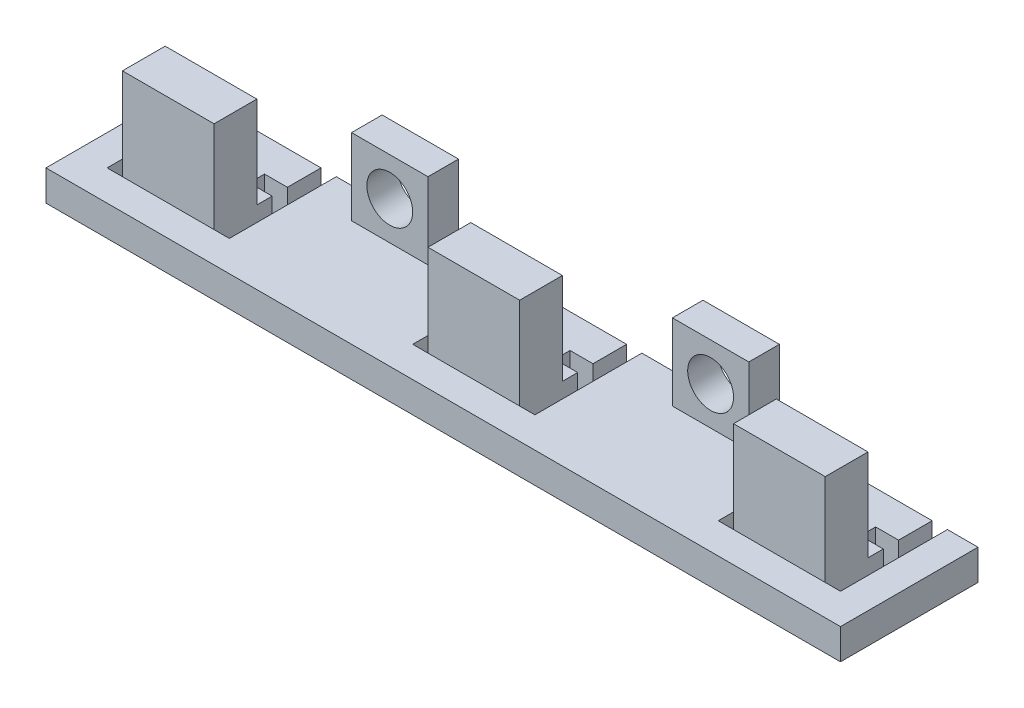
from build123d import *

# Parameters (mm, degrees)
SKETCH_1_W             = 52
SKETCH_1_H             = 9
EXTRUDE_1_DEPTH        = 2
SKETCH_1_5_W           = 1
SKETCH_1_5_H           = 7
SKETCH_1_5_W_2         = 1.5
SKETCH_1_5_H_2         = 1
CUT_EXTRUDE_2_DEPTH    = 53.810983706
EXTRUDE_START          = 2
SKETCH_1_6_W           = 6
SKETCH_1_6_H           = 2.8
EXTRUDE_2_DEPTH        = 6
PATTERN_LINEAR_1_COUNT = 3
PATTERN_LINEAR_1_PITCH = 20
SKETCH_1_7_W           = 5
SKETCH_1_7_H           = 2
EXTRUDE_3_DEPTH        = 5
SKETCH_2_R             = 1.5
CUT_EXTRUDE_3_DEPTH    = 54.075418039


with BuildPart() as part:
    # 草图1 → 凸台-拉伸1 (new body)
    with BuildSketch(Plane(origin=(0, 0, 0), x_dir=(1, 0, 0), z_dir=(0, 1, 0))):
        with Locations((26, -4.5)):
            Rectangle(SKETCH_1_W, SKETCH_1_H)
    extrude(amount=EXTRUDE_1_DEPTH)

    # 草图1<5> → 切除-拉伸2 (cut, through all)
    with BuildSketch(Plane(origin=(0, 0, 0), x_dir=(1, 0, 0), z_dir=(0, 1, 0))):
        with Locations((9.5, -3.5)):
            Rectangle(SKETCH_1_5_W, SKETCH_1_5_H)
        with Locations((2.5, -3.5)):
            Rectangle(SKETCH_1_5_W, SKETCH_1_5_H)
        with Locations((3.75, -2.7)):
            Rectangle(SKETCH_1_5_W_2, SKETCH_1_5_H_2)
        with Locations((8.25, -2.7)):
            Rectangle(SKETCH_1_5_W_2, SKETCH_1_5_H_2)
    cut_extrude_2 = extrude(amount=CUT_EXTRUDE_2_DEPTH, mode=Mode.SUBTRACT)

    # 草图1<6> → 凸台-拉伸2 (add)
    with BuildSketch(Plane(origin=(0, 0, 0), x_dir=(1, 0, 0), z_dir=(0, 1, 0)).offset(EXTRUDE_START)):
        with Locations((6, -5.6)):
            Rectangle(SKETCH_1_6_W, SKETCH_1_6_H)
    extrude_2 = extrude(amount=EXTRUDE_2_DEPTH)

    # 阵列(线性)1: 切除-拉伸2, 凸台-拉伸2 ×3
    with Locations(*[(i * PATTERN_LINEAR_1_PITCH, 0, 0) for i in range(1, PATTERN_LINEAR_1_COUNT)]):
        add(cut_extrude_2, mode=Mode.SUBTRACT)
        add(extrude_2)

    # 草图1<7> → 凸台-拉伸3 (add)
    with BuildSketch(Plane(origin=(0, 0, 0), x_dir=(1, 0, 0), z_dir=(0, 1, 0)).offset(EXTRUDE_START)):
        with Locations((15.5, -1)):
            Rectangle(SKETCH_1_7_W, SKETCH_1_7_H)
        with Locations((36.5, -1)):
            Rectangle(SKETCH_1_7_W, SKETCH_1_7_H)
    extrude(amount=EXTRUDE_3_DEPTH)

    # 草图2 → 切除-拉伸3 (cut, through all)
    with BuildSketch(Plane.XY.offset(2)):
        with Locations((36.5, 4.5)):
            Circle(SKETCH_2_R)
        with Locations((15.5, 4.5)):
            Circle(SKETCH_2_R)
    extrude(amount=-CUT_EXTRUDE_3_DEPTH, mode=Mode.SUBTRACT)


solid = part.part
